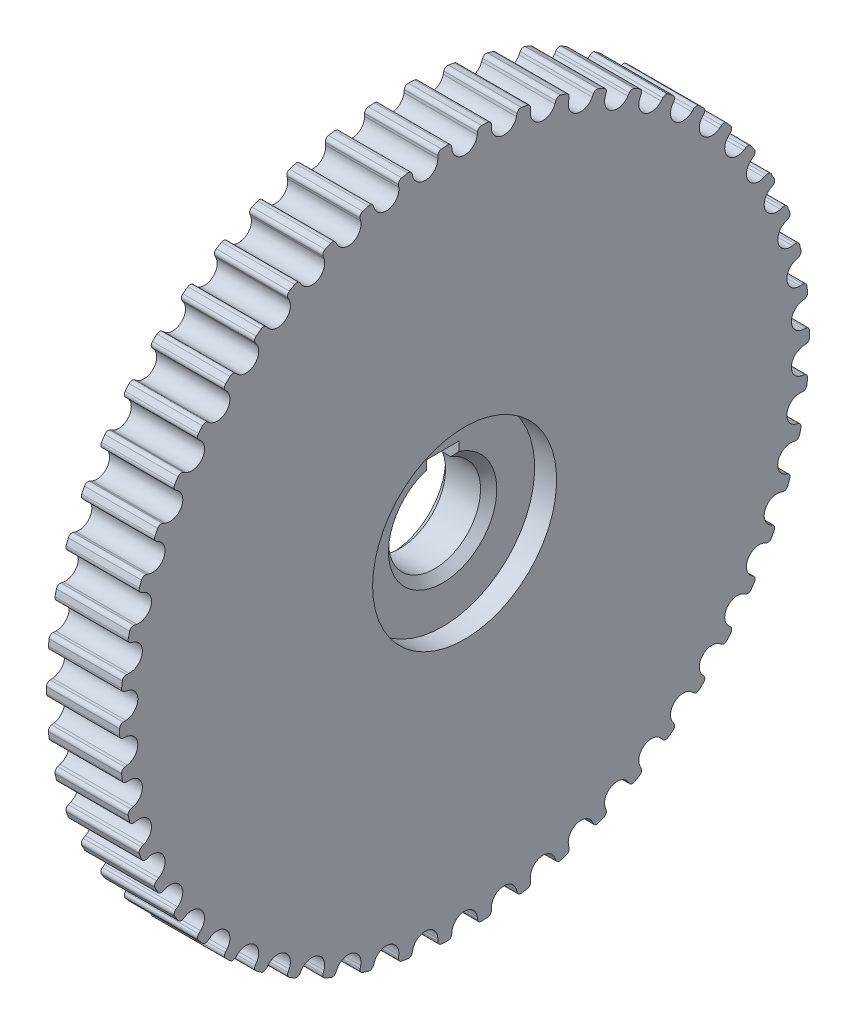
from build123d import *

# Parameters (mm, degrees)
CHAMFER_1_SIZE           = 1
SKETCH_4_W               = 4
SKETCH_4_H               = 2.165562586
CUT_EXTRUDE_1_DEPTH      = 61.631516623
CUT_EXTRUDE_2_REACH      = 62.632
PATTERN_CIRCULAR_3_COUNT = 54


with BuildPart() as part:
    # 草图1 → 旋转1 (revolve)
    with BuildSketch(Plane.XY):
        Polygon((0, 5.6538), (0, 42.398), (9, 42.398), (9, 11.3076), (6.3, 11.3076), (6.3, 5.6538), align=None)
    revolve(axis=Axis((0, 0, 0), (1, 0, 0)))

    # 倒角1
    chamfer_1_edges = [part.edges().sort_by_distance(p)[0] for p in [
        (6.3, -5.6538, 0),
        (0, -5.6538, 0),
    ]]
    chamfer(chamfer_1_edges, length=CHAMFER_1_SIZE)

    # 草图4 → 切除-拉伸1 (cut, through all)
    with BuildSketch(Plane.ZY):
        with Locations((0, 6.371018659)):
            Rectangle(SKETCH_4_W, SKETCH_4_H)
    extrude(amount=-CUT_EXTRUDE_1_DEPTH, mode=Mode.SUBTRACT)

    # 草图6 → 切除-拉伸2 (cut, up to next)
    with BuildSketch(Plane(origin=(0, 0, 0), x_dir=(0, 0, -1), z_dir=(1, 0, 0)), mode=Mode.PRIVATE) as cut_extrude_2_sk1:
        with BuildLine():
            Line((1.587390135, 41.925661063), (1.548371997, 41.607883824))
            ThreePointArc((1.548371997, 41.607883824), (0, 40.238), (-1.548371997, 41.607883824))
            Line((-1.548371997, 41.607883824), (-1.587390135, 41.925661063))
            ThreePointArc((-1.587390135, 41.925661063), (-1.754703668, 42.234385593), (-2.087444854, 42.346581656))
            ThreePointArc((-2.087444854, 42.346581656), (-2.327120349, 42.334086914), (-2.566721276, 42.320235655))
            Line((-2.566721276, 42.320235655), (-2.763369264, 43.921804997))
            ThreePointArc((-2.763369264, 43.921804997), (0, 44.00864874), (2.763369264, 43.921804997))
            Line((2.763369264, 43.921804997), (2.566721276, 42.320235655))
            ThreePointArc((2.566721276, 42.320235655), (2.327120349, 42.334086914), (2.087444854, 42.346581656))
            ThreePointArc((2.087444854, 42.346581656), (1.754703668, 42.234385593), (1.587390135, 41.925661063))
        make_face()
    cut_extrude_2_tool1 = extrude(cut_extrude_2_sk1.sketch, amount=CUT_EXTRUDE_2_REACH, mode=Mode.PRIVATE) & part.part
    cut_extrude_2 = cut_extrude_2_tool1.solids().sort_by_distance((0, 42.492252, 0))[0]
    add(cut_extrude_2, mode=Mode.SUBTRACT)

    # 阵列(圆周)3: 切除-拉伸2 ×54 about axis
    pattern_circular_3_axis = Axis((-1.4, 0, 0), (1, 0, 0))
    for i in range(1, PATTERN_CIRCULAR_3_COUNT):
        add(cut_extrude_2.rotate(pattern_circular_3_axis, i * 360 / PATTERN_CIRCULAR_3_COUNT), mode=Mode.SUBTRACT)


solid = part.part
